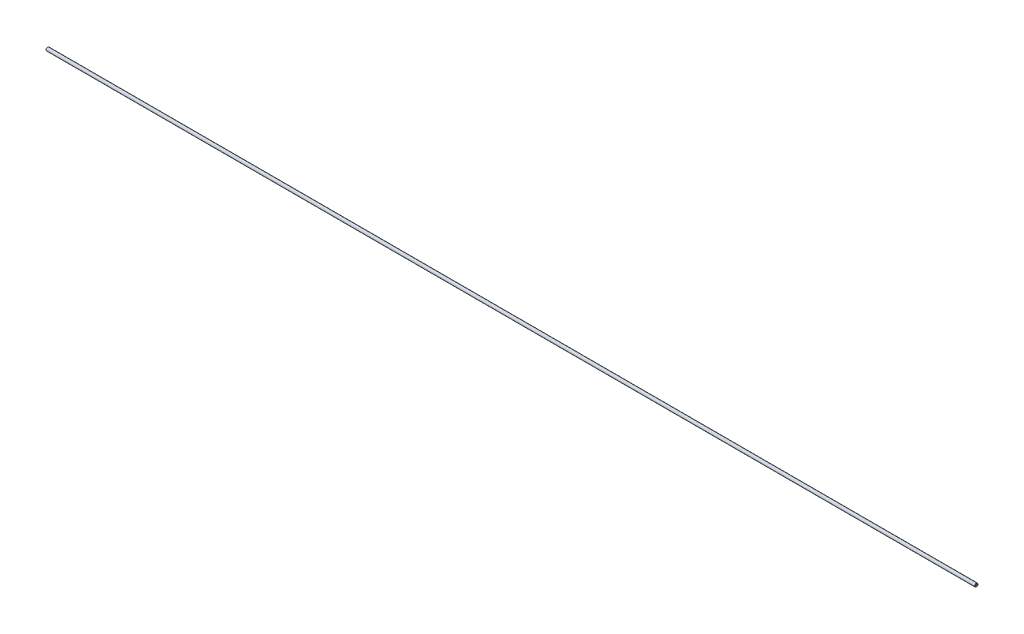
from build123d import *

# Parameters (mm, degrees)
SKETCH1_R           = 25.4
BOSS_EXTRUDE1_DEPTH = 14373.606
SKETCH2_R           = 12.7
CUT_EXTRUDE1_DEPTH  = 14374.650884978


with BuildPart() as part:
    # Sketch1 → Boss-Extrude1 (new body)
    with BuildSketch(Plane.YZ):
        with Locations(Location((0, 0, 0), (0, 0, 270))):
            Circle(SKETCH1_R)
    extrude(amount=BOSS_EXTRUDE1_DEPTH)

    # Sketch2 → Cut-Extrude1 (cut, through all)
    with BuildSketch(Plane.YZ.offset(14373.606)):
        with Locations(Location((0, 0, 0), (0, 0, 270))):
            Circle(SKETCH2_R)
    extrude(amount=-CUT_EXTRUDE1_DEPTH, mode=Mode.SUBTRACT)


solid = part.part
